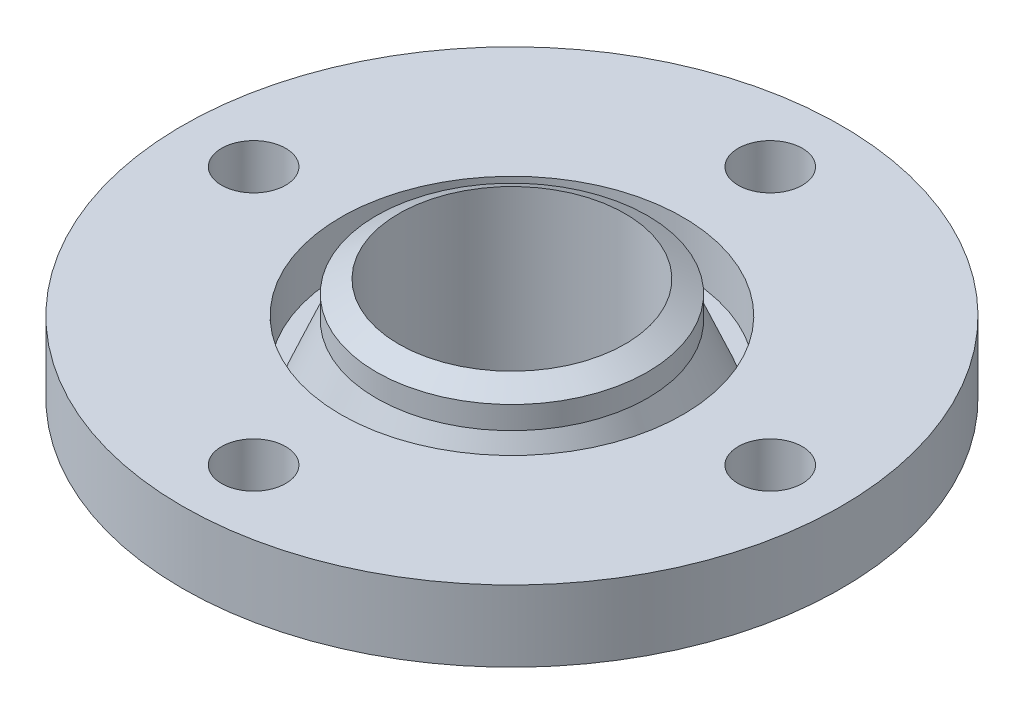
from build123d import *

# Parameters (mm, degrees)
CUTSKETCH_W             = 9
CUTSKETCH_H             = 22
BOLTCIRCLEPATTERN_COUNT = 4


with BuildPart() as part:
    # BaseSketch → BaseRevolve (revolve)
    with BuildSketch(Plane.XY):
        Polygon((-31.75, 0), (-31.75, -45), (-59, -45), (-59, -29), (-92.5, -29), (-92.5, -9), (-48, -9), (-48, -23), (-54, -29), (-46, -29), (-38.05, -10), (-38.05, -3.637306696), align=None)
    revolve(axis=Axis((0, 0, 0), (0, -1, 0)))

    # CutSketch → CenterRevCut (revolve, cut)
    with BuildSketch(Plane.XY):
        with Locations((-77, -19)):
            Rectangle(CUTSKETCH_W, CUTSKETCH_H)
    centerrevcut = revolve(axis=Axis((-72.5, 10.805368121, 0), (0, -1, 0)), mode=Mode.SUBTRACT)

    # BoltCirclePattern: CenterRevCut ×4 about axis
    boltcirclepattern_axis = Axis((0, 0, 0), (0, -1, 0))
    for i in range(1, BOLTCIRCLEPATTERN_COUNT):
        add(centerrevcut.rotate(boltcirclepattern_axis, i * 360 / BOLTCIRCLEPATTERN_COUNT), mode=Mode.SUBTRACT)


solid = part.part
